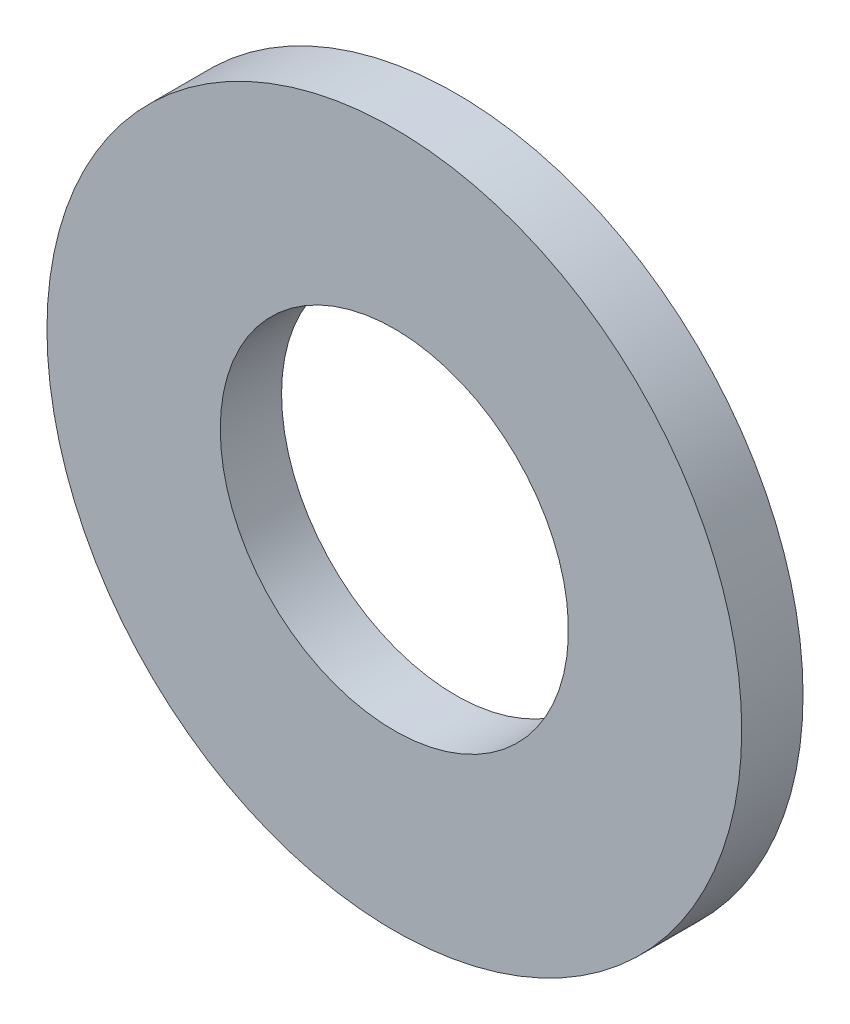
from build123d import *

# Parameters (mm, degrees)
SCHIZZO2_R                   = 4.42
SCHIZZO2_R_2                 = 2.215
ESTRUSIONE_ESTRUSIONE1_DEPTH = 0.78


with BuildPart() as part:
    # Schizzo2 → Estrusione-Estrusione1 (new body)
    with BuildSketch(Plane.XY):
        with Locations(Location((0, 0, 0), (0, 0, 180))):
            Circle(SCHIZZO2_R)
        with Locations(Location((0, 0, 0), (0, 0, 180))):
            Circle(SCHIZZO2_R_2, mode=Mode.SUBTRACT)
    extrude(amount=ESTRUSIONE_ESTRUSIONE1_DEPTH)


solid = part.part
